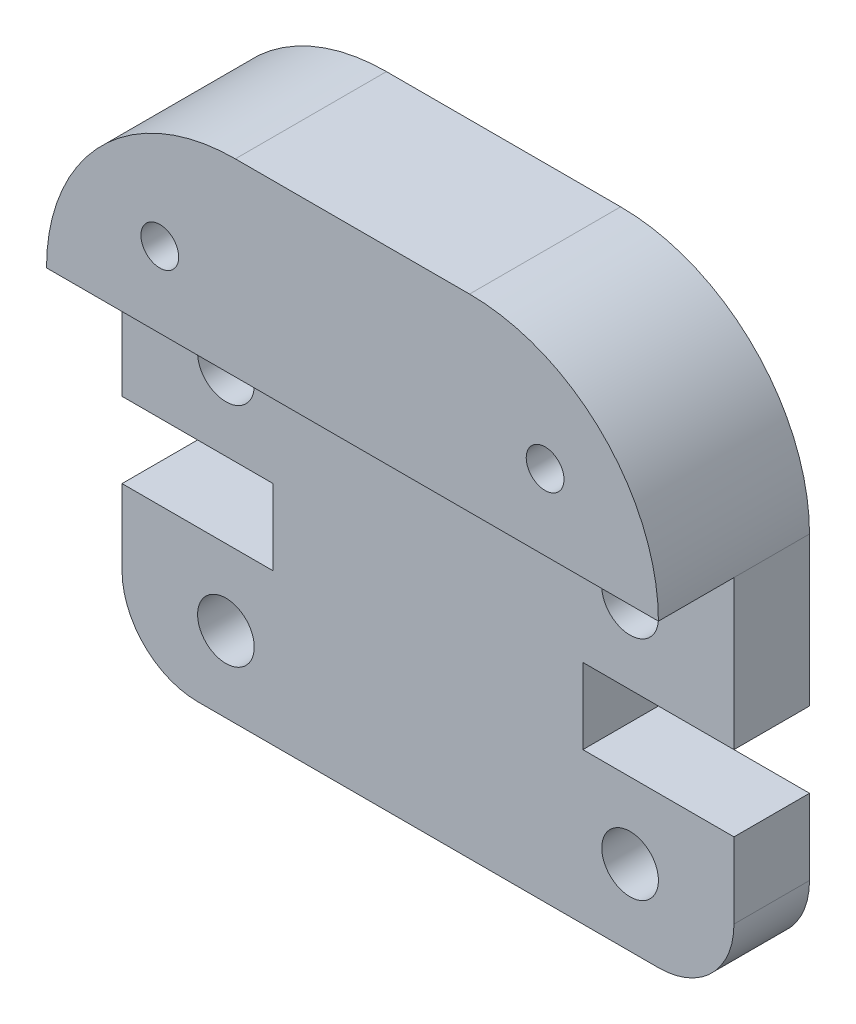
from build123d import *

# Parameters (mm, degrees)
SKETCH2_R           = 0.75
SKETCH2_R_2         = 0.5
BOSS_EXTRUDE1_DEPTH = 4
SKETCH3_W           = 16.2
SKETCH3_H           = 9.945
CUT_EXTRUDE2_DEPTH  = 2


with BuildPart() as part:
    # Sketch2 → Boss-Extrude1 (new body)
    with BuildSketch(Plane.XY):
        with BuildLine():
            Line((0, 9.945), (0, 6))
            Line((0, 6), (4, 6))
            Line((4, 6), (4, 4))
            Line((4, 4), (0, 4))
            Line((0, 4), (0, 2))
            ThreePointArc((0, 2), (0.585786438, 0.585786438), (2, 0))
            Line((2, 0), (14.2, 0))
            ThreePointArc((14.2, 0), (15.614213562, 0.585786438), (16.2, 2))
            Line((16.2, 2), (16.2, 4))
            Line((16.2, 4), (12.2, 4))
            Line((12.2, 4), (12.2, 6))
            Line((12.2, 6), (16.2, 6))
            Line((16.2, 6), (16.2, 9.945))
            ThreePointArc((16.2, 9.945), (14.735533906, 13.480533906), (11.2, 14.945))
            Line((11.2, 14.945), (5, 14.945))
            ThreePointArc((5, 14.945), (1.464466094, 13.480533906), (0, 9.945))
        make_face()
        with Locations((13.45, 8)):
            Circle(SKETCH2_R, mode=Mode.SUBTRACT)
        with Locations((13.45, 2)):
            Circle(SKETCH2_R, mode=Mode.SUBTRACT)
        with Locations((13.2, 11.942)):
            Circle(SKETCH2_R_2, mode=Mode.SUBTRACT)
        with Locations((3, 11.942)):
            Circle(SKETCH2_R_2, mode=Mode.SUBTRACT)
        with Locations((2.75, 2)):
            Circle(SKETCH2_R, mode=Mode.SUBTRACT)
        with Locations((2.75, 8)):
            Circle(SKETCH2_R, mode=Mode.SUBTRACT)
    extrude(amount=BOSS_EXTRUDE1_DEPTH)

    # Sketch3 → Cut-Extrude2 (cut)
    with BuildSketch(Plane(origin=(0, 0, 4), x_dir=(-1, 0, 0), z_dir=(0, 0, -1))):
        with Locations((-8.1, 4.9725)):
            Rectangle(SKETCH3_W, SKETCH3_H)
    extrude(amount=CUT_EXTRUDE2_DEPTH, mode=Mode.SUBTRACT)


solid = part.part
